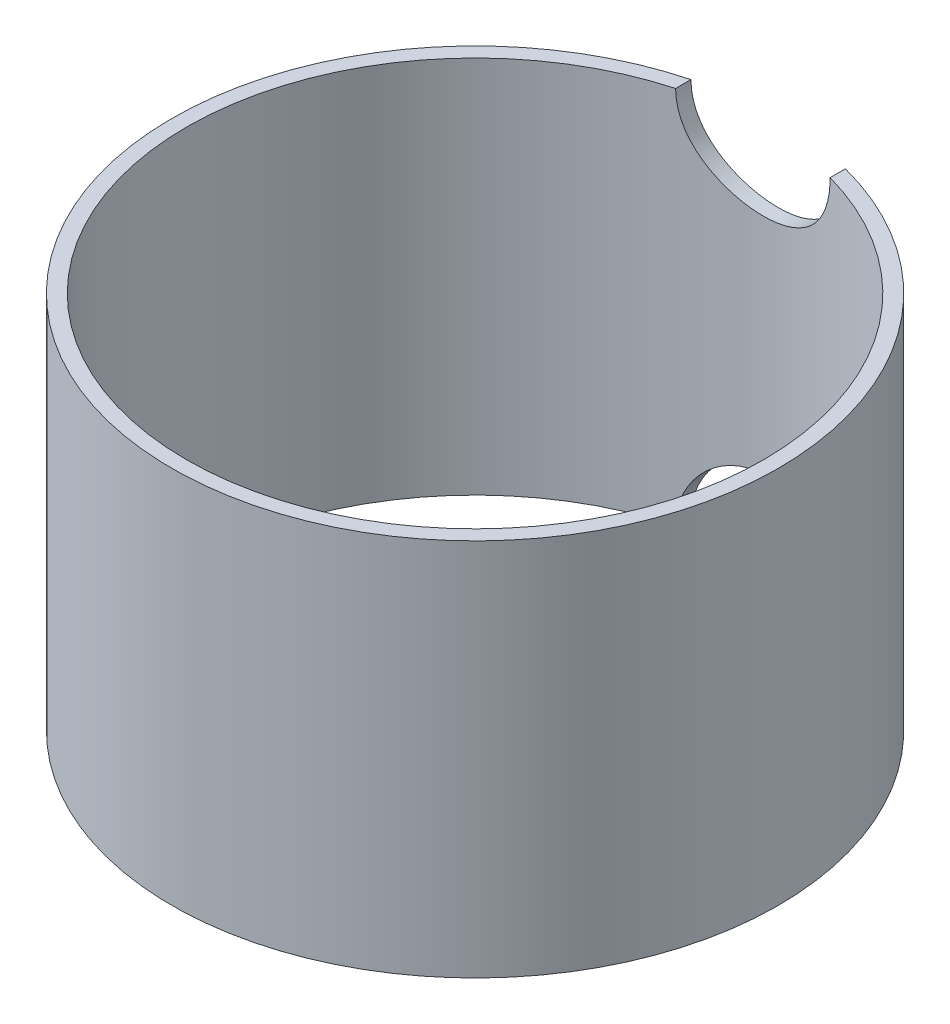
from build123d import *

# Parameters (mm, degrees)
SKETCH1_R           = 41
SKETCH1_R_2         = 39
BOSS_EXTRUDE1_DEPTH = 51.2
SKETCH2_R           = 10.45
CUT_EXTRUDE1_DEPTH  = 78.352698725


with BuildPart() as part:
    # Sketch1 → Boss-Extrude1 (new body)
    with BuildSketch(Plane(origin=(0, 0, 0), x_dir=(1, 0, 0), z_dir=(0, 1, 0))):
        with Locations(Location((0, 0, 0), (0, 0, 270))):
            Circle(SKETCH1_R)
        with Locations(Location((0, 0, 0), (0, 0, 270))):
            Circle(SKETCH1_R_2, mode=Mode.SUBTRACT)
    extrude(amount=BOSS_EXTRUDE1_DEPTH)

    # Sketch2 → Cut-Extrude1 (cut, through all)
    with BuildSketch(Plane.XY):
        with Locations((0, 51.2)):
            Circle(SKETCH2_R)
        Circle(SKETCH2_R)
    extrude(amount=-CUT_EXTRUDE1_DEPTH, mode=Mode.SUBTRACT)


solid = part.part
